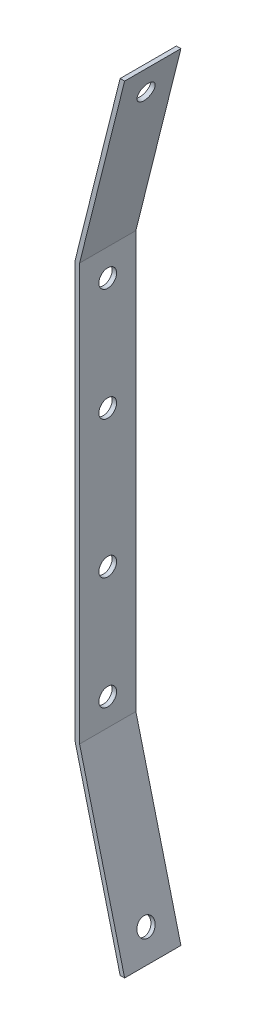
from build123d import *

# Parameters (mm, degrees)
SKETCH1_W           = 0.508
SKETCH1_H           = 46.99
BOSS_EXTRUDE1_DEPTH = 6.35
SKETCH2_R           = 1
CUT_EXTRUDE1_DEPTH  = 6.35
SKETCH3_R           = 1
CUT_EXTRUDE2_DEPTH  = 6.35
SKETCH4_R           = 1
CUT_EXTRUDE3_DEPTH  = 2.54


with BuildPart() as part:
    # Sketch1 → Boss-Extrude1 (new body)
    with BuildSketch(Plane.XY):
        with Locations((0.254, 23.495)):
            Rectangle(SKETCH1_W, SKETCH1_H)
        Polygon((0, 46.99), (0.508, 46.99), (5.588, 67.31), (5.08, 67.31), align=None)
        Polygon((5.588, -20.32), (0.508, 0), (0, 0), (5.08, -20.32), align=None)
    extrude(amount=BOSS_EXTRUDE1_DEPTH)

    # Sketch2 → Cut-Extrude1 (cut)
    with BuildSketch(Plane.ZY):
        with Locations((3.175, 3.048)):
            Circle(SKETCH2_R)
        with Locations((3.175, 15.748)):
            Circle(SKETCH2_R)
        with Locations((3.175, 43.942)):
            Circle(SKETCH2_R)
        with Locations((3.175, 31.242)):
            Circle(SKETCH2_R)
    extrude(amount=-CUT_EXTRUDE1_DEPTH, mode=Mode.SUBTRACT)

    # Sketch3 → Cut-Extrude2 (cut)
    with BuildSketch(Plane(origin=(-11.056470588, 2.764117647, 0), x_dir=(0, 0, 1), z_dir=(-0.9701425001453319, 0.24253562503633325, 0))):
        with Locations(Location((3.175, 63.53237266, 0), (0, 0, 270))):
            Circle(SKETCH3_R)
    extrude(amount=-CUT_EXTRUDE2_DEPTH, mode=Mode.SUBTRACT)

    # Sketch4 → Cut-Extrude3 (cut)
    with BuildSketch(Plane(origin=(0.478117647, 0.119529412, 0), x_dir=(0, 0, -1), z_dir=(0.9701425001453319, 0.24253562503633308, 0))):
        with Locations(Location((-3.175, -17.945376578, 0), (0, 0, 90))):
            Circle(SKETCH4_R)
    extrude(amount=-CUT_EXTRUDE3_DEPTH, mode=Mode.SUBTRACT)


solid = part.part
